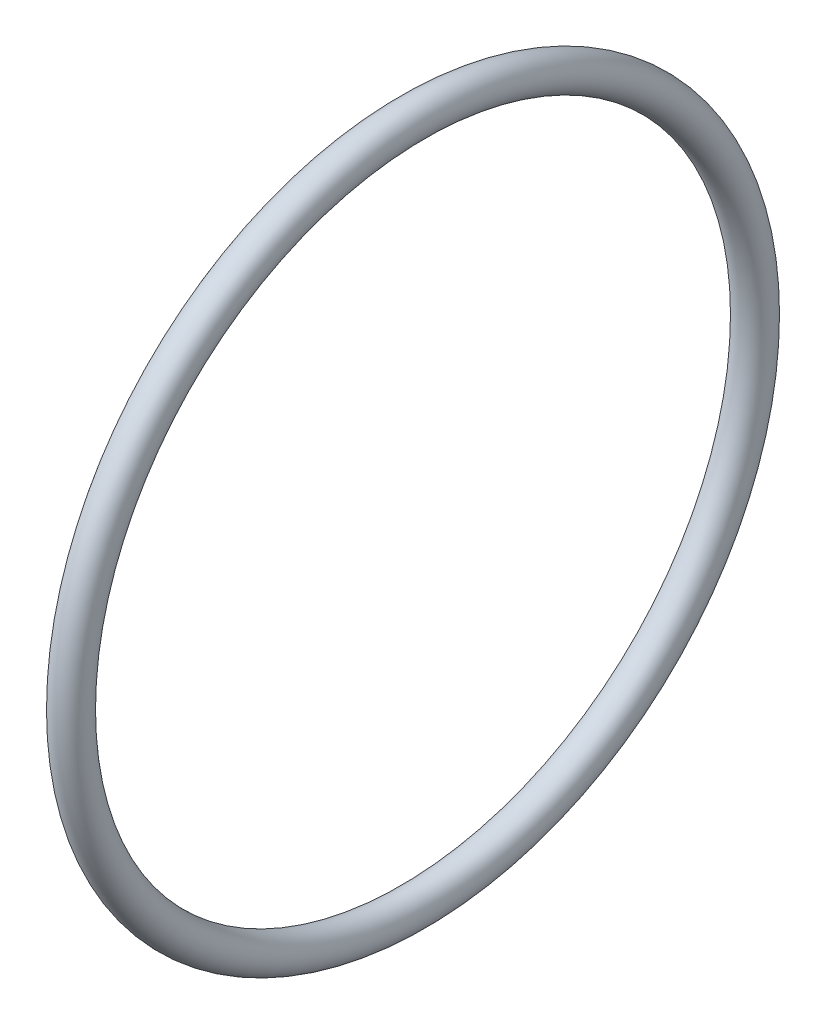
from build123d import *

# Parameters (mm, degrees)
SCHIZZO2_R = 1


with BuildPart() as part:
    # Schizzo2 → Rivoluzione1 (revolve)
    with BuildSketch(Plane.XY, mode=Mode.PRIVATE) as rivoluzione1_sk:
        with Locations((0, 19.715)):
            Circle(SCHIZZO2_R)
    revolve(rivoluzione1_sk.sketch.rotate(Axis((-1.1, 0, 0), (1, 0, 0)), 90), axis=Axis((-1.1, 0, 0), (1, 0, 0)))


solid = part.part
